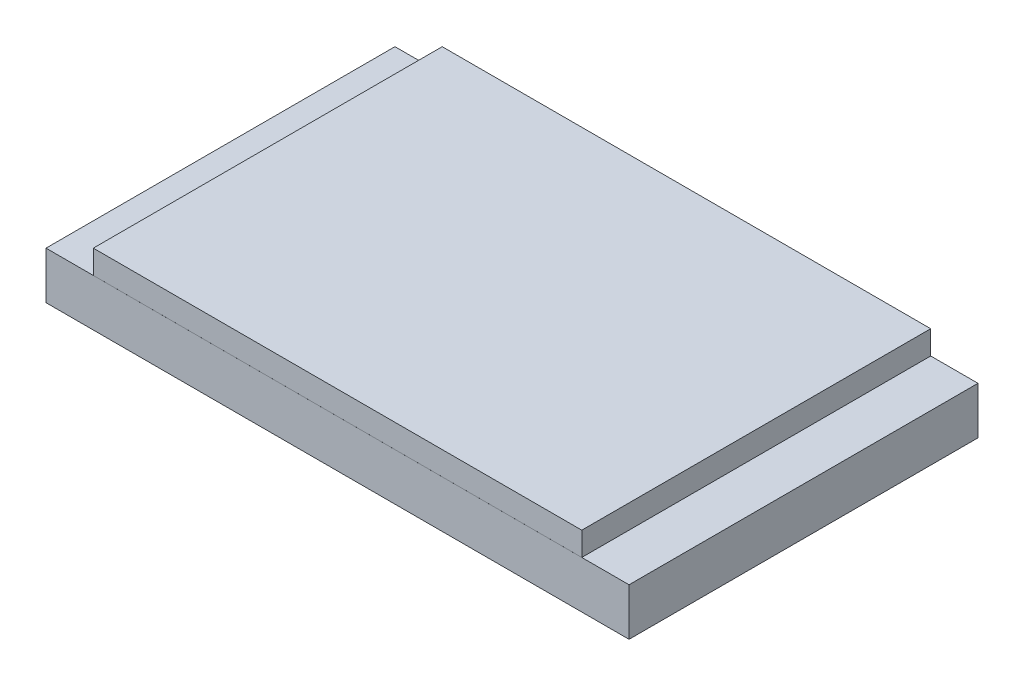
from build123d import *

# Parameters (mm, degrees)
BOSS_EXTRUDE1_START = 2
SKETCH1_W           = 41.337660338
SKETCH1_H           = 29.52690024
BOSS_EXTRUDE1_DEPTH = 2
BOSS_EXTRUDE2_START = -2
SKETCH2_W           = 49.34
SKETCH2_H           = 29.53
BOSS_EXTRUDE2_DEPTH = 4


with BuildPart() as part:
    # Sketch1 → Boss-Extrude1 (new body)
    with BuildSketch(Plane(origin=(0, 0, 0), x_dir=(1, 0, 0), z_dir=(0, 1, 0)).offset(BOSS_EXTRUDE1_START)):
        Rectangle(SKETCH1_W, SKETCH1_H)
    extrude(amount=BOSS_EXTRUDE1_DEPTH)

    # Sketch2 → Boss-Extrude2 (add)
    with BuildSketch(Plane(origin=(0, 0, 0), x_dir=(1, 0, 0), z_dir=(0, 1, 0)).offset(BOSS_EXTRUDE2_START)):
        Rectangle(SKETCH2_W, SKETCH2_H)
    extrude(amount=BOSS_EXTRUDE2_DEPTH)


solid = part.part
